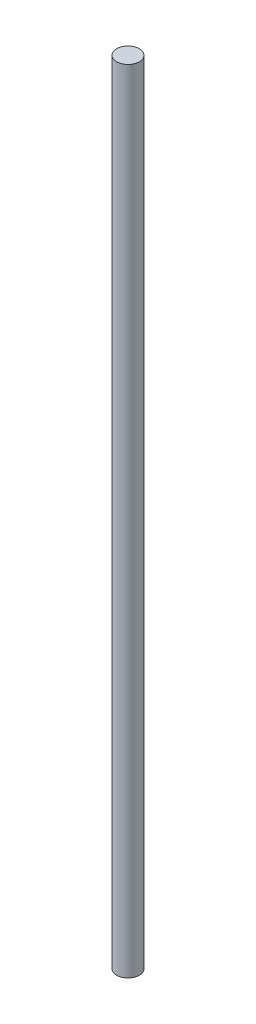
from build123d import *

# Parameters (mm, degrees)
SKETCH1_R           = 2
BOSS_EXTRUDE1_DEPTH = 140


with BuildPart() as part:
    # Sketch1 → Boss-Extrude1 (new body)
    with BuildSketch(Plane(origin=(0, 0, 0), x_dir=(1, 0, 0), z_dir=(0, 1, 0))):
        with Locations(Location((0, 0, 0), (0, 0, 270))):
            Circle(SKETCH1_R)
    extrude(amount=BOSS_EXTRUDE1_DEPTH)


solid = part.part
